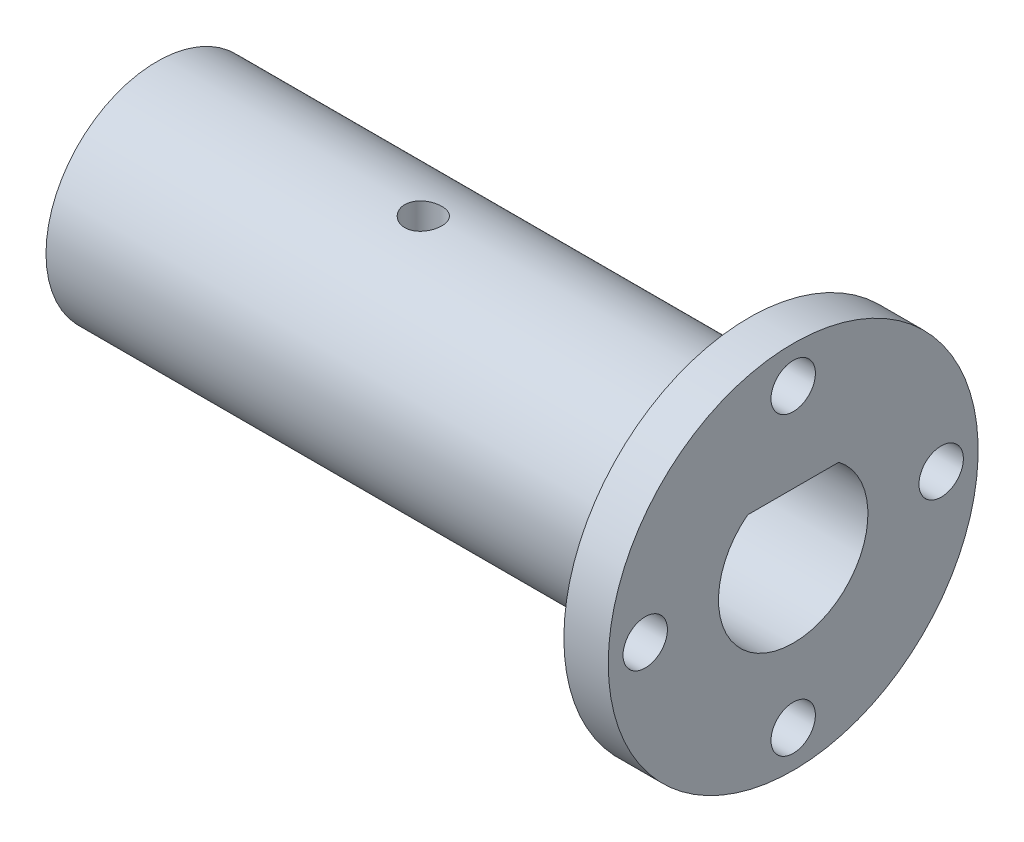
from build123d import *

# Parameters (mm, degrees)
SKETCH_1_W            = 3
SKETCH_1_H            = 12.5
SKETCH_2_R            = 7.5
EXTRUDE_1_DEPTH       = 40
CUT_EXTRUDE_1_DEPTH   = 47.491934784
HOLE_WIZARD_3_0_3_3_D = 3
SKETCH_9_R            = 1.25
CUT_EXTRUDE_2_DEPTH   = 10


with BuildPart() as part:
    # 草图1 → 旋转1 (revolve)
    with BuildSketch(Plane(origin=(0, 0, 0), x_dir=(-1, 0, 0), z_dir=(0, 0, -1)), mode=Mode.PRIVATE) as revolve_1_sk:
        with Locations((-41.5, 6.25)):
            Rectangle(SKETCH_1_W, SKETCH_1_H)
    revolve(revolve_1_sk.sketch.rotate(Axis((43, 0, 0), (-1, 0, 0)), 270), axis=Axis((43, 0, 0), (-1, 0, 0)))

    # 草图2 → 凸台-拉伸1 (add)
    with BuildSketch(Plane.ZY.offset(-40)):
        Circle(SKETCH_2_R)
    extrude(amount=EXTRUDE_1_DEPTH)

    # 草图3 → 切除-拉伸1 (cut, through all)
    with BuildSketch(Plane.ZY):
        with BuildLine():
            Line((3.082612528, 4), (-3.082612528, 4))
            ThreePointArc((-3.082612528, 4), (0, -5.05), (3.082612528, 4))
        make_face()
    extrude(amount=-CUT_EXTRUDE_1_DEPTH, mode=Mode.SUBTRACT)

    # Ø3.0 (3) 直径孔3 (through all)
    with Locations(Plane.ZY.offset(-40)):
        with Locations((10, 0), (0, -10), (-10, 0), (0, 10)):
            Hole(HOLE_WIZARD_3_0_3_3_D / 2)

    # 草图9 → 切除-拉伸2 (cut)
    with BuildSketch(Plane.XZ.offset(-4)):
        with Locations(Location((18, 0, 0), (0, 0, 270))):
            Circle(SKETCH_9_R)
    extrude(amount=-CUT_EXTRUDE_2_DEPTH, mode=Mode.SUBTRACT)


solid = part.part
